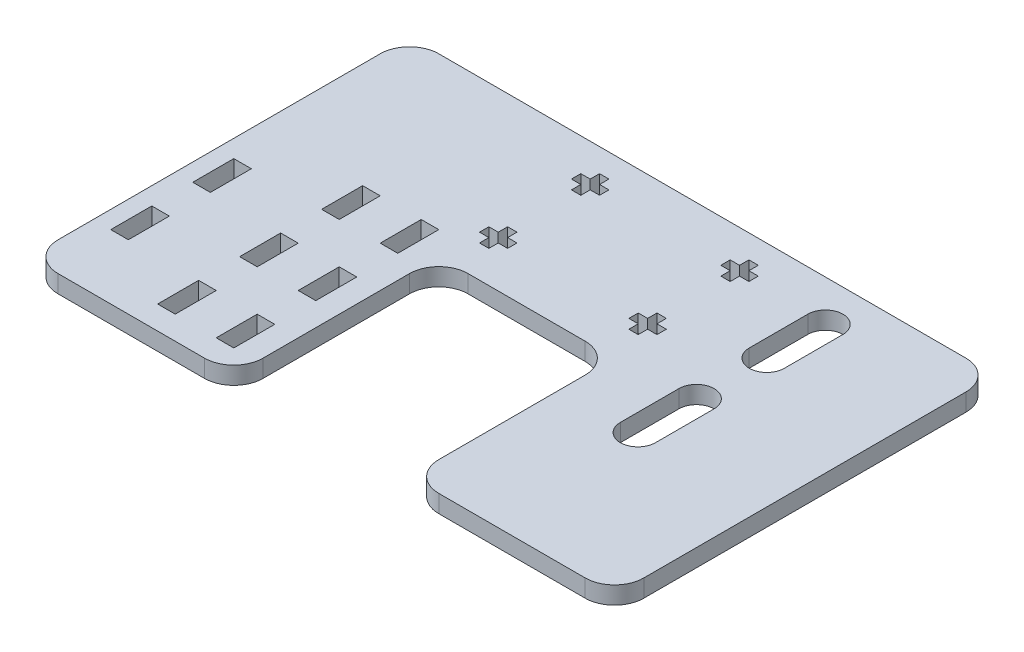
from build123d import *

# Parameters (mm, degrees)
BOSS_EXTRUDE1_DEPTH  = 3
FILLET1_R            = 5
FILLET2_R            = 5
SKETCH2_W            = 3
SKETCH2_H            = 7
CUT_EXTRUDE1_DEPTH   = 3
LPATTERN1_COUNT      = 3
LPATTERN1_PITCH      = 14
LPATTERN1_COUNT_DIR2 = 2
LPATTERN1_PITCH_DIR2 = 10
CUT_EXTRUDE2_DEPTH   = 3
LPATTERN2_COUNT      = 2
LPATTERN2_PITCH      = 25.5
LPATTERN2_COUNT_DIR2 = 2
LPATTERN2_PITCH_DIR2 = 15.7
FILLET3_R            = 5
FILLET4_R            = 5
FILLET5_R            = 5
FILLET6_R            = 5
FILLET7_R            = 5
FILLET8_R            = 5
CUT_EXTRUDE3_DEPTH   = 3
LPATTERN3_COUNT      = 2
LPATTERN3_PITCH      = 22
SKETCH5_W            = 3
SKETCH5_H            = 7
CUT_EXTRUDE4_DEPTH   = 3
LPATTERN4_COUNT      = 2
LPATTERN4_PITCH      = 14


with BuildPart() as part:
    # Sketch1 → Boss-Extrude1 (new body)
    with BuildSketch(Plane(origin=(0, 0, 0), x_dir=(1, 0, 0), z_dir=(0, 1, 0))):
        Polygon((15, -32.5), (50, -32.5), (50, 32.5), (-50, 32.5), (-50, -32.5), (-15, -32.5), (-15, 2.5), (15, 2.5), align=None)
    extrude(amount=BOSS_EXTRUDE1_DEPTH)

    # Fillet1
    fillet1_edges = [part.edges().sort_by_distance(p)[0] for p in [
        (-15, 1.5, -2.5),
    ]]
    fillet(fillet1_edges, radius=FILLET1_R)

    # Fillet2
    fillet2_edges = [part.edges().sort_by_distance(p)[0] for p in [
        (15, 1.5, -2.5),
    ]]
    fillet(fillet2_edges, radius=FILLET2_R)

    # Sketch2 → Cut-Extrude1 (cut)
    with BuildSketch(Plane(origin=(0, 3, 0), x_dir=(1, 0, 0), z_dir=(0, 1, 0))):
        with Locations((-20.5, 3)):
            Rectangle(SKETCH2_W, SKETCH2_H)
    cut_extrude1 = extrude(amount=-CUT_EXTRUDE1_DEPTH, mode=Mode.SUBTRACT)

    # LPattern1: Cut-Extrude1 3 × 2
    with Locations(*[(-j * LPATTERN1_PITCH_DIR2, 0, i * LPATTERN1_PITCH) for i in range(LPATTERN1_COUNT) for j in range(LPATTERN1_COUNT_DIR2) if (i, j) != (0, 0)]):
        add(cut_extrude1, mode=Mode.SUBTRACT)

    # Sketch3 → Cut-Extrude2 (cut)
    with BuildSketch(Plane(origin=(0, 3, 0), x_dir=(1, 0, 0), z_dir=(0, 1, 0))):
        Polygon((-13.55, 28.5), (-11.95, 28.5), (-11.95, 26.9), (-10.35, 26.9), (-10.35, 25.3), (-11.95, 25.3), (-11.95, 23.7), (-13.55, 23.7), (-13.55, 25.3), (-15.15, 25.3), (-15.15, 26.9), (-13.55, 26.9), align=None)
    cut_extrude2 = extrude(amount=-CUT_EXTRUDE2_DEPTH, mode=Mode.SUBTRACT)

    # LPattern2: Cut-Extrude2 2 × 2
    with Locations(*[(i * LPATTERN2_PITCH, 0, j * LPATTERN2_PITCH_DIR2) for i in range(LPATTERN2_COUNT) for j in range(LPATTERN2_COUNT_DIR2) if (i, j) != (0, 0)]):
        add(cut_extrude2, mode=Mode.SUBTRACT)

    # Fillet3
    fillet3_edges = [part.edges().sort_by_distance(p)[0] for p in [
        (-50, 1.5, -32.5),
    ]]
    fillet(fillet3_edges, radius=FILLET3_R)

    # Fillet4
    fillet4_edges = [part.edges().sort_by_distance(p)[0] for p in [
        (50, 1.5, -32.5),
    ]]
    fillet(fillet4_edges, radius=FILLET4_R)

    # Fillet5
    fillet5_edges = [part.edges().sort_by_distance(p)[0] for p in [
        (-50, 1.5, 32.5),
    ]]
    fillet(fillet5_edges, radius=FILLET5_R)

    # Fillet6
    fillet6_edges = [part.edges().sort_by_distance(p)[0] for p in [
        (50, 1.5, 32.5),
    ]]
    fillet(fillet6_edges, radius=FILLET6_R)

    # Fillet7
    fillet7_edges = [part.edges().sort_by_distance(p)[0] for p in [
        (15, 1.5, 32.5),
    ]]
    fillet(fillet7_edges, radius=FILLET7_R)

    # Fillet8
    fillet8_edges = [part.edges().sort_by_distance(p)[0] for p in [
        (-15, 1.5, 32.5),
    ]]
    fillet(fillet8_edges, radius=FILLET8_R)

    # Sketch4 → Cut-Extrude3 (cut)
    with BuildSketch(Plane(origin=(0, 3, 0), x_dir=(1, 0, 0), z_dir=(0, 1, 0))):
        with BuildLine():
            Line((31, 25.5), (31, 15.5))
            ThreePointArc((31, 15.5), (28, 12.5), (25, 15.5))
            Line((25, 15.5), (25, 25.5))
            ThreePointArc((25, 25.5), (28, 28.5), (31, 25.5))
        make_face()
    cut_extrude3 = extrude(amount=-CUT_EXTRUDE3_DEPTH, mode=Mode.SUBTRACT)

    # LPattern3: Cut-Extrude3 ×2
    with Locations(*[(0, 0, i * LPATTERN3_PITCH) for i in range(1, LPATTERN3_COUNT)]):
        add(cut_extrude3, mode=Mode.SUBTRACT)

    # Sketch5 → Cut-Extrude4 (cut)
    with BuildSketch(Plane(origin=(0, 3, 0), x_dir=(1, 0, 0), z_dir=(0, 1, 0))):
        with Locations((-45.5, -4)):
            Rectangle(SKETCH5_W, SKETCH5_H)
    cut_extrude4 = extrude(amount=-CUT_EXTRUDE4_DEPTH, mode=Mode.SUBTRACT)

    # LPattern4: Cut-Extrude4 ×2
    with Locations(*[(0, 0, i * LPATTERN4_PITCH) for i in range(1, LPATTERN4_COUNT)]):
        add(cut_extrude4, mode=Mode.SUBTRACT)


solid = part.part
